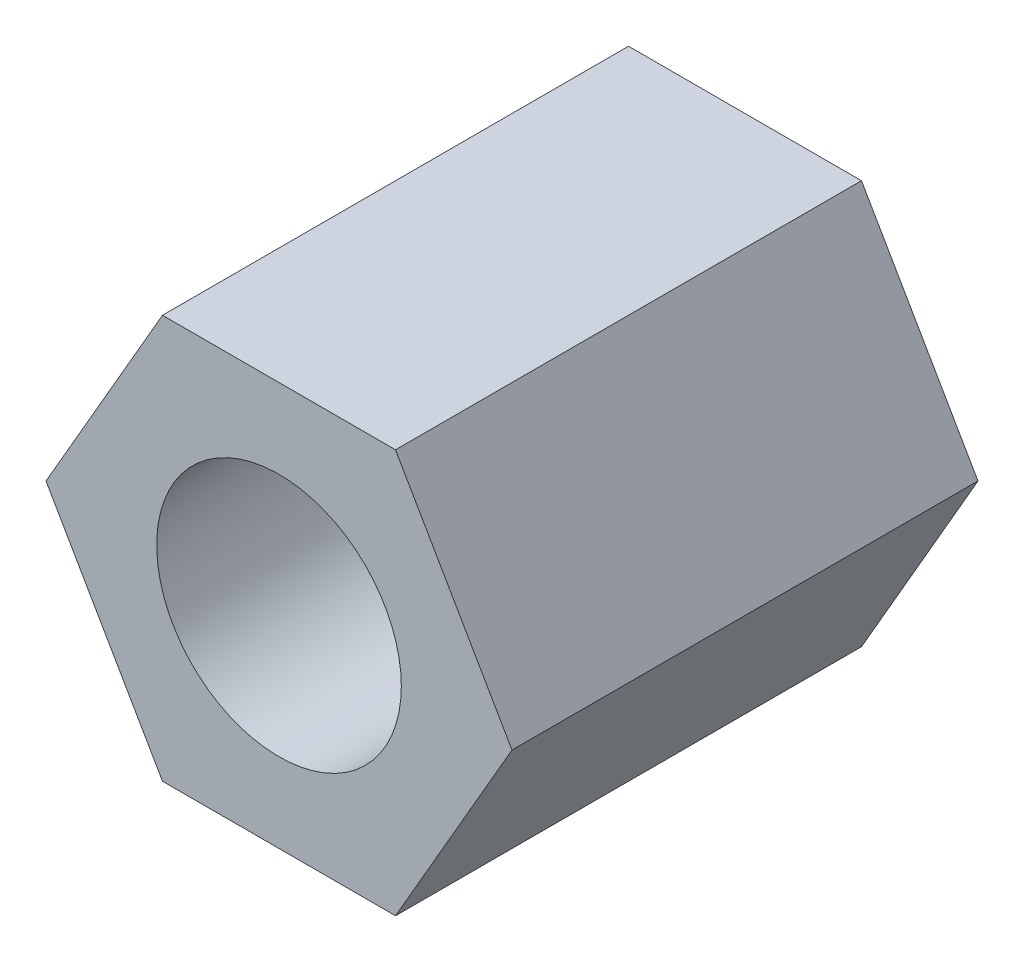
from build123d import *

# Parameters (mm, degrees)
EXTRUDE_1_DEPTH  = 8
HOLE_WIZARD_M5_D = 4.2


with BuildPart() as part:
    # 草图1 → 凸台-拉伸1 (new body)
    with BuildSketch(Plane.XY):
        Polygon((0, 0), (4, 0), (6, -3.464101615), (4, -6.92820323), (0, -6.92820323), (-2, -3.464101615), align=None)
    extrude(amount=EXTRUDE_1_DEPTH)

    # M5 (through all)
    with Locations(Plane.XY.offset(8)):
        with Locations((2, -3.464101615)):
            Hole(HOLE_WIZARD_M5_D / 2)


solid = part.part
